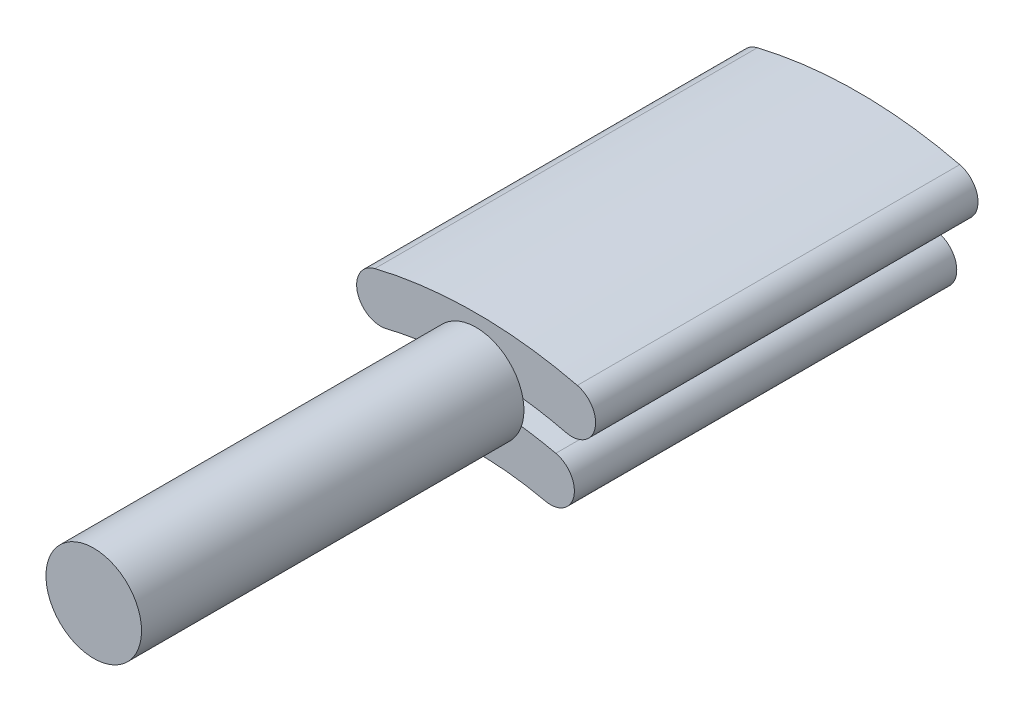
from build123d import *

# Parameters (mm, degrees)
BOSS_EXTRUDE1_DEPTH   = 50.8
BOSS_EXTRUDE1_2_DEPTH = 50.8
SKETCH2_R             = 6.35
BOSS_EXTRUDE2_DEPTH   = 50.8


with BuildPart() as part:
    # Sketch1 → Boss-Extrude1 (new body)
    with BuildSketch(Plane.XY):
        with BuildLine():
            ThreePointArc((-11.952941176, 49.373750083), (0, 50.8), (11.952941176, 49.373750083))
            ThreePointArc((11.952941176, 49.373750083), (15.78585938, 51.712550639), (13.447058824, 55.545468843))
            ThreePointArc((13.447058824, 55.545468843), (0, 57.15), (-13.447058824, 55.545468843))
            ThreePointArc((-13.447058824, 55.545468843), (-15.78585938, 51.712550639), (-11.952941176, 49.373750083))
        make_face()
    extrude(amount=-BOSS_EXTRUDE1_DEPTH)



with BuildPart() as body_2:
    # Sketch1 → Boss-Extrude1 2 (new body)
    with BuildSketch(Plane.XY):
        with BuildLine():
            ThreePointArc((-10.586266882, 46.303249967), (0, 47.498), (10.586266882, 46.303249967))
            ThreePointArc((10.586266882, 46.303249967), (12.973765752, 42.500474776), (9.170990561, 40.112975907))
            ThreePointArc((9.170990561, 40.112975907), (0, 41.148), (-9.170990561, 40.112975907))
            ThreePointArc((-9.170990561, 40.112975907), (-12.973765752, 42.500474776), (-10.586266882, 46.303249967))
        make_face()
    extrude(amount=-BOSS_EXTRUDE1_2_DEPTH)


with BuildPart() as part_1:
    add(part.part)

    add(body_2.part)  # Boss-Extrude2 merges body 2
    # Sketch2 → Boss-Extrude2 (add)
    with BuildSketch(Plane.XY):
        with Locations(Location((0, 49.149, 0), (0, 0, 168.476640001))):
            Circle(SKETCH2_R)
    extrude(amount=BOSS_EXTRUDE2_DEPTH)


solid = part_1.part
